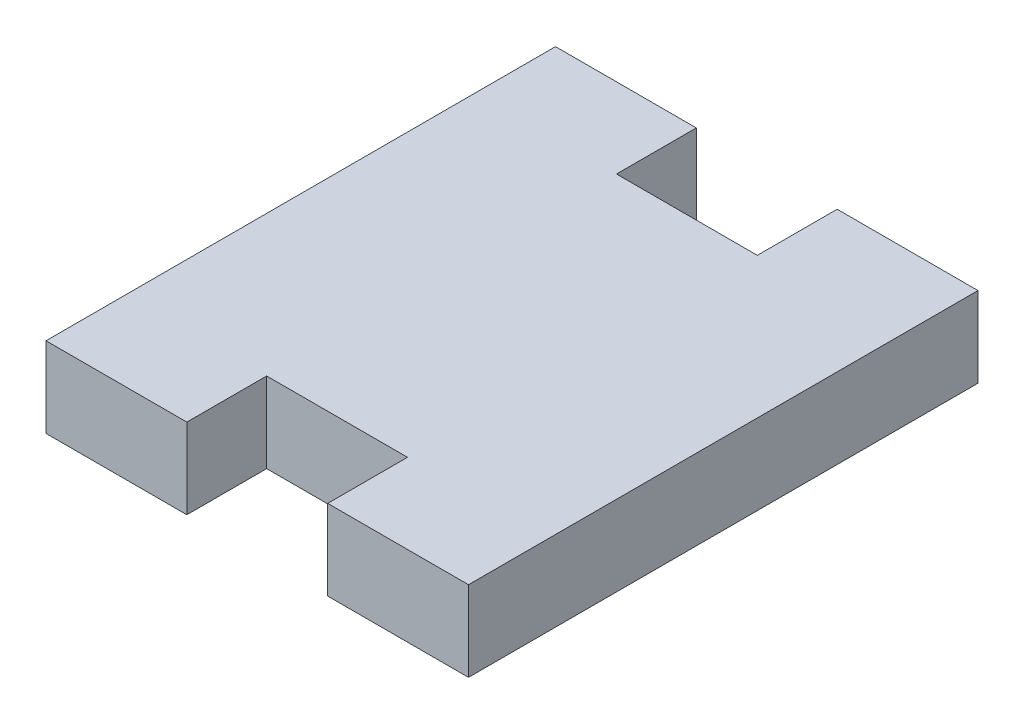
from build123d import *

# Parameters (mm, degrees)
SKETCH1_W           = 50.8
SKETCH1_H           = 50.8
BOSS_EXTRUDE1_DEPTH = 4.826
SKETCH2_W           = 50.8
SKETCH2_H           = 20.169999896
CUT_EXTRUDE1_DEPTH  = 73.003960141
SKETCH3_W           = 25.4
SKETCH3_H           = 30.630000104
CUT_EXTRUDE2_DEPTH  = 60.515772551
SKETCH4_W           = 8.466666666
SKETCH4_H           = 4.800000052
CUT_EXTRUDE3_DEPTH  = 60.515772551


with BuildPart() as part:
    # Sketch1 → Boss-Extrude1 (new body)
    with BuildSketch(Plane(origin=(0, 0, 0), x_dir=(1, 0, 0), z_dir=(0, 1, 0))):
        with Locations((25.4, 25.4)):
            Rectangle(SKETCH1_W, SKETCH1_H)
    extrude(amount=BOSS_EXTRUDE1_DEPTH)

    # Sketch2 → Cut-Extrude1 (cut, through all)
    with BuildSketch(Plane.XZ):
        with Locations((25.4, -40.715000052)):
            Rectangle(SKETCH2_W, SKETCH2_H)
    extrude(amount=-CUT_EXTRUDE1_DEPTH, mode=Mode.SUBTRACT)

    # Sketch3 → Cut-Extrude2 (cut, through all)
    with BuildSketch(Plane.XZ):
        with Locations((12.7, -15.315000052)):
            Rectangle(SKETCH3_W, SKETCH3_H)
    extrude(amount=-CUT_EXTRUDE2_DEPTH, mode=Mode.SUBTRACT)

    # Sketch4 → Cut-Extrude3 (cut, through all)
    with BuildSketch(Plane(origin=(0, 4.826, 0), x_dir=(1, 0, 0), z_dir=(0, 1, 0))):
        with Locations((38.1, 2.400000026)):
            Rectangle(SKETCH4_W, SKETCH4_H)
        with Locations((38.1, 28.230000078)):
            Rectangle(SKETCH4_W, SKETCH4_H)
    extrude(amount=-CUT_EXTRUDE3_DEPTH, mode=Mode.SUBTRACT)


solid = part.part
